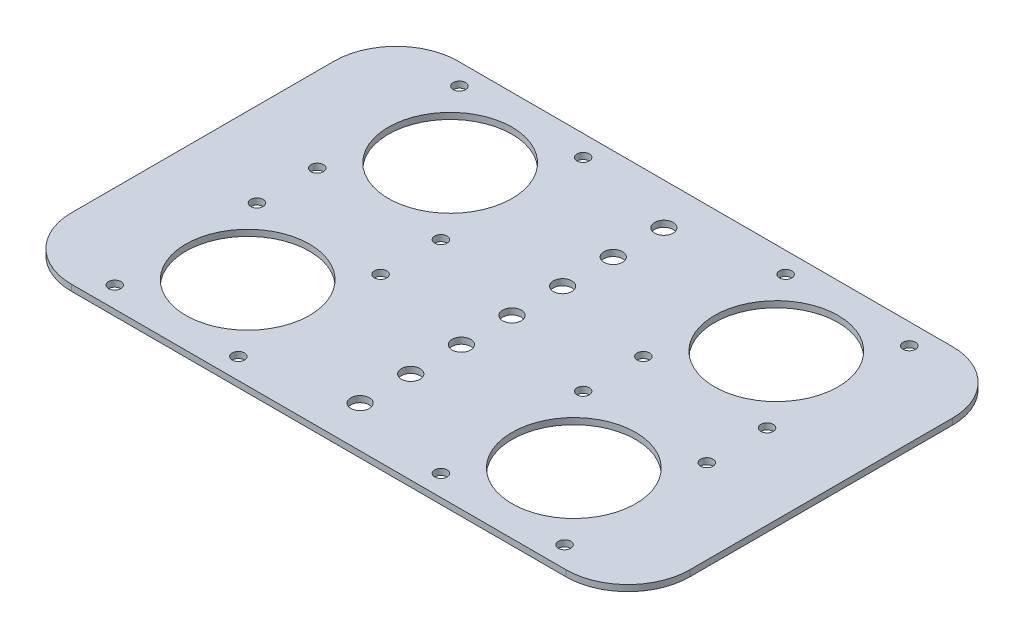
from build123d import *

# Parameters (mm, degrees)
SKETCH_1_W          = 200
SKETCH_1_H          = 125
EXTRUDE_1_DEPTH     = 2
SKETCH_2_R          = 2
CUT_EXTRUDE_1_DEPTH = 236.858008132
SKETCH_3_R          = 20
SKETCH_3_R_2        = 3
CUT_EXTRUDE_2_DEPTH = 236.858008132
FILLET_1_R          = 20


with BuildPart() as part:
    # Эскиз1 → Бобышка-Вытянуть1 (new body)
    with BuildSketch(Plane(origin=(0, 0, 0), x_dir=(1, 0, 0), z_dir=(0, 1, 0))):
        with Locations((100, 62.5)):
            Rectangle(SKETCH_1_W, SKETCH_1_H)
    extrude(amount=EXTRUDE_1_DEPTH)

    # Эскиз2 → Вырез-Вытянуть1 (cut, through all)
    with BuildSketch(Plane.XZ):
        with Locations(Location((27.25, -6.75, 0), (0, 0, 270))):
            Circle(SKETCH_2_R)
        with Locations(Location((67.25, -6.75, 0), (0, 0, 270))):
            Circle(SKETCH_2_R)
        with Locations(Location((132.75, -6.75, 0), (0, 0, 270))):
            Circle(SKETCH_2_R)
        with Locations(Location((172.75, -6.75, 0), (0, 0, 270))):
            Circle(SKETCH_2_R)
        with Locations(Location((172.75, -52.75, 0), (0, 0, 270))):
            Circle(SKETCH_2_R)
        with Locations(Location((132.75, -52.75, 0), (0, 0, 270))):
            Circle(SKETCH_2_R)
        with Locations(Location((132.75, -72.25, 0), (0, 0, 270))):
            Circle(SKETCH_2_R)
        with Locations(Location((172.75, -72.25, 0), (0, 0, 270))):
            Circle(SKETCH_2_R)
        with Locations(Location((132.75, -118.25, 0), (0, 0, 270))):
            Circle(SKETCH_2_R)
        with Locations(Location((172.75, -118.25, 0), (0, 0, 270))):
            Circle(SKETCH_2_R)
        with Locations(Location((27.25, -52.75, 0), (0, 0, 270))):
            Circle(SKETCH_2_R)
        with Locations(Location((67.25, -52.75, 0), (0, 0, 270))):
            Circle(SKETCH_2_R)
        with Locations(Location((27.25, -72.25, 0), (0, 0, 270))):
            Circle(SKETCH_2_R)
        with Locations(Location((67.25, -72.25, 0), (0, 0, 270))):
            Circle(SKETCH_2_R)
        with Locations(Location((67.25, -118.25, 0), (0, 0, 270))):
            Circle(SKETCH_2_R)
        with Locations(Location((27.25, -118.25, 0), (0, 0, 270))):
            Circle(SKETCH_2_R)
    extrude(amount=-CUT_EXTRUDE_1_DEPTH, mode=Mode.SUBTRACT)

    # Эскиз3 → Вырез-Вытянуть2 (cut, through all)
    with BuildSketch(Plane.XZ):
        with Locations(Location((47.25, -29.75, 0), (0, 0, 270))):
            Circle(SKETCH_3_R)
        with Locations(Location((152.75, -29.75, 0), (0, 0, 270))):
            Circle(SKETCH_3_R)
        with Locations(Location((152.75, -95.25, 0), (0, 0, 270))):
            Circle(SKETCH_3_R)
        with Locations(Location((47.25, -95.25, 0), (0, 0, 270))):
            Circle(SKETCH_3_R)
        with Locations(Location((100, -62.5, 0), (0, 0, 270))):
            Circle(SKETCH_3_R_2)
        with Locations(Location((100, -29.75, 0), (0, 0, 270))):
            Circle(SKETCH_3_R_2)
        with Locations(Location((100, -95.25, 0), (0, 0, 270))):
            Circle(SKETCH_3_R_2)
        with Locations(Location((100, -13.375, 0), (0, 0, 270))):
            Circle(SKETCH_3_R_2)
        with Locations(Location((100, -46.125, 0), (0, 0, 270))):
            Circle(SKETCH_3_R_2)
        with Locations(Location((100, -78.875, 0), (0, 0, 270))):
            Circle(SKETCH_3_R_2)
        with Locations(Location((100, -111.625, 0), (0, 0, 270))):
            Circle(SKETCH_3_R_2)
    extrude(amount=-CUT_EXTRUDE_2_DEPTH, mode=Mode.SUBTRACT)

    # Скругление1
    fillet_1_edges = [part.edges().sort_by_distance(p)[0] for p in [
        (0, 1, -125),
        (200, 1, -125),
        (200, 1, 0),
        (0, 1, 0),
    ]]
    fillet(fillet_1_edges, radius=FILLET_1_R)


solid = part.part
